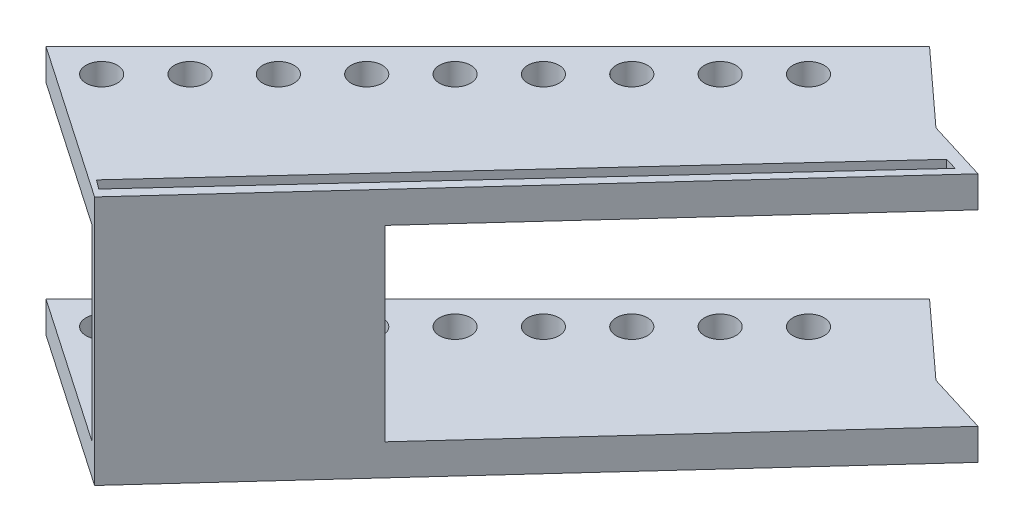
from build123d import *

# Parameters (mm, degrees)
BOSS_EXTRUDE1_DEPTH = 101.6
SKETCH2_W           = 267.926874414
SKETCH2_H           = 76.2
CUT_EXTRUDE1_DEPTH  = 71.12
SKETCH3_R           = 6.35
CUT_EXTRUDE3_DEPTH  = 313.194791695
CUT_EXTRUDE4_DEPTH  = 7.62
CUT_EXTRUDE5_DEPTH  = 7.62


with BuildPart() as part:
    # Sketch1 → Boss-Extrude1 (new body)
    with BuildSketch(Plane(origin=(0, 0, 0), x_dir=(1, 0, 0), z_dir=(0, 1, 0))):
        Polygon((0, 0), (179.605122421, 179.605122421), (209.535625582, 152.272255569), (234.275538547, 144.630280974), (62.844388347, -43.093188015), align=None)
    extrude(amount=BOSS_EXTRUDE1_DEPTH)

    # Sketch2 → Cut-Extrude1 (cut)
    with BuildSketch(Plane(origin=(0, 0, 0), x_dir=(-0.7071067811865464, 0, 0.7071067811865487), z_dir=(-0.7071067811865487, 0, -0.7071067811865464))):
        with Locations((-133.963437207, 50.8)):
            Rectangle(SKETCH2_W, SKETCH2_H)
    extrude(amount=-CUT_EXTRUDE1_DEPTH, mode=Mode.SUBTRACT)

    # Sketch3 → Cut-Extrude3 (cut, through all)
    with BuildSketch(Plane(origin=(0, 101.6, 0), x_dir=(1, 0, 0), z_dir=(0, 1, 0))):
        with Locations(Location((21.07252481, 1.552947287, 0), (0, 0, 270))):
            Circle(SKETCH3_R)
        with Locations(Location((39.033037052, 19.513459529, 0), (0, 0, 270))):
            Circle(SKETCH3_R)
        with Locations(Location((56.993549294, 37.473971772, 0), (0, 0, 270))):
            Circle(SKETCH3_R)
        with Locations(Location((74.954061536, 55.434484014, 0), (0, 0, 270))):
            Circle(SKETCH3_R)
        with Locations(Location((92.914573778, 73.394996256, 0), (0, 0, 270))):
            Circle(SKETCH3_R)
        with Locations(Location((110.87508602, 91.355508498, 0), (0, 0, 270))):
            Circle(SKETCH3_R)
        with Locations(Location((128.835598263, 109.31602074, 0), (0, 0, 270))):
            Circle(SKETCH3_R)
        with Locations(Location((146.796110505, 127.276532982, 0), (0, 0, 270))):
            Circle(SKETCH3_R)
        with Locations(Location((164.756622747, 145.237045224, 0), (0, 0, 270))):
            Circle(SKETCH3_R)
    extrude(amount=-CUT_EXTRUDE3_DEPTH, mode=Mode.SUBTRACT)

    # Sketch4 → Cut-Extrude4 (cut)
    with BuildSketch(Plane(origin=(0, 101.6, 0), x_dir=(1, 0, 0), z_dir=(0, 1, 0))):
        Polygon((57.221000047, -36.701269589), (222.746181499, 143.313374464), (227.72700376, 141.940671831), (60.924166757, -39.463469017), align=None)
    extrude(amount=-CUT_EXTRUDE4_DEPTH, mode=Mode.SUBTRACT)

    # Sketch5 → Cut-Extrude5 (cut)
    with BuildSketch(Plane(origin=(0, 0, 0), x_dir=(-1, 0, 0), z_dir=(0, -1, 0))):
        Polygon((-218.913299563, 144.742548401), (-62.856752097, -25.376237408), (-58.071451081, -30.592741372), (-62.856752097, -34.982483231), (-227.725480711, 144.742548401), align=None)
    extrude(amount=-CUT_EXTRUDE5_DEPTH, mode=Mode.SUBTRACT)


solid = part.part
